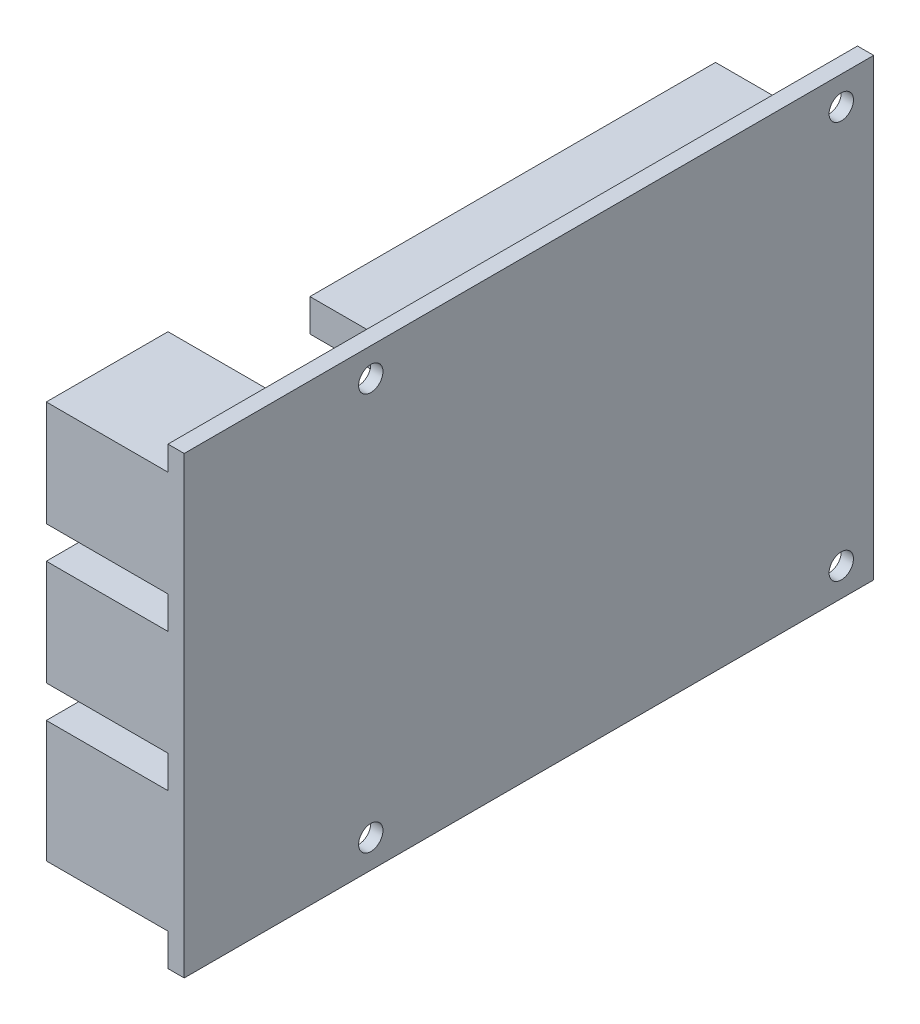
from build123d import *

# Parameters (mm, degrees)
ESQUISSE1_W             = 85
ESQUISSE1_H             = 56
BOSS_EXTRU_1_DEPTH      = 2
ESQUISSE2_W             = 20
ESQUISSE2_H             = 15
ESQUISSE2_W_2           = 15
ESQUISSE2_H_2           = 13
BOSS_EXTRU_2_DEPTH      = 15
ESQUISSE3_R             = 1.5
ENL_V_MAT_EXTRU_1_DEPTH = 15
ESQUISSE5_R             = 2.5
ENL_V_MAT_EXTRU_2_DEPTH = 0.5
ESQUISSE6_W             = 50
ESQUISSE6_H             = 4
BOSS_EXTRU_3_DEPTH      = 9


with BuildPart() as part:
    # Esquisse1 → Boss.-Extru.1 (new body)
    with BuildSketch(Plane(origin=(0, 0, 0), x_dir=(0, 0, -1), z_dir=(1, 0, 0))):
        Rectangle(ESQUISSE1_W, ESQUISSE1_H)
    extrude(amount=BOSS_EXTRU_1_DEPTH)

    # Esquisse2 → Boss.-Extru.2 (add)
    with BuildSketch(Plane.ZY):
        with Locations((32.5, -16.5)):
            Rectangle(ESQUISSE2_W, ESQUISSE2_H)
        with Locations((35, 1.5)):
            Rectangle(ESQUISSE2_W_2, ESQUISSE2_H_2)
        with Locations((35, 18.5)):
            Rectangle(ESQUISSE2_W_2, ESQUISSE2_H_2)
    extrude(amount=BOSS_EXTRU_2_DEPTH)

    # Esquisse3 → Enlèv. mat.-Extru.1 (cut)
    with BuildSketch(Plane.ZY):
        with Locations((-38.5, 24.5)):
            Circle(ESQUISSE3_R)
        with Locations((19.5, 24.5)):
            Circle(ESQUISSE3_R)
        with Locations((-38.5, -24.5)):
            Circle(ESQUISSE3_R)
        with Locations((19.5, -24.5)):
            Circle(ESQUISSE3_R)
    extrude(amount=-ENL_V_MAT_EXTRU_1_DEPTH, mode=Mode.SUBTRACT)

    # Esquisse5 → Enlèv. mat.-Extru.2 (cut)
    with BuildSketch(Plane.ZY):
        with Locations((19.5, 24.5)):
            Circle(ESQUISSE5_R)
        with Locations((-38.5, 24.5)):
            Circle(ESQUISSE5_R)
        with Locations(Location((-38.5, -24.5, 0), (0, 0, 180))):
            Circle(ESQUISSE5_R)
        with Locations(Location((19.5, -24.5, 0), (0, 0, 180))):
            Circle(ESQUISSE5_R)
    extrude(amount=-ENL_V_MAT_EXTRU_2_DEPTH, mode=Mode.SUBTRACT)

    # Esquisse6 → Boss.-Extru.3 (add)
    with BuildSketch(Plane.ZY):
        with Locations((-9, 24)):
            Rectangle(ESQUISSE6_W, ESQUISSE6_H)
    extrude(amount=BOSS_EXTRU_3_DEPTH)


solid = part.part
